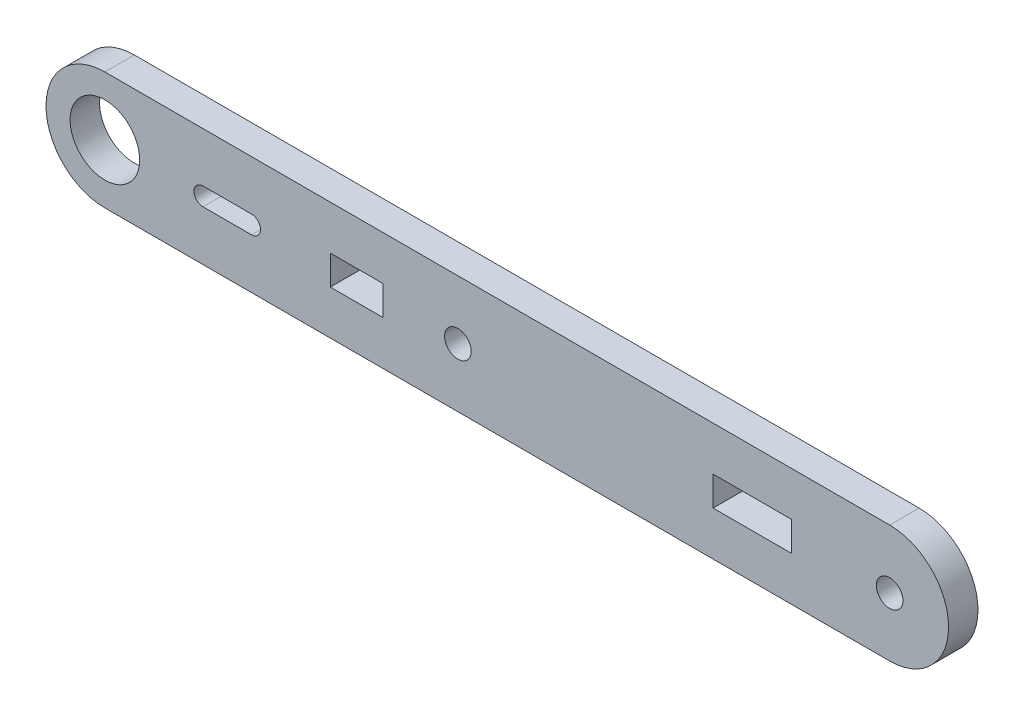
from build123d import *

# Parameters (mm, degrees)
SKETCH_1_R      = 3.543825796
SKETCH_1_R_2    = 1.357591064
SKETCH_1_W      = 5.3728
SKETCH_1_H      = 3.0001
SKETCH_1_W_2    = 7.9992
EXTRUDE_1_DEPTH = 3


with BuildPart() as part:
    # 草图1 → 凸台-拉伸1 (new body)
    with BuildSketch(Plane.XY.offset(3)):
        with BuildLine():
            Line((-49.343510787, 0), (30.618171933, 0))
            ThreePointArc((30.618171933, 0), (36.618171933, 6), (30.618171933, 12))
            Line((30.618171933, 12), (-49.343510787, 12))
            ThreePointArc((-49.343510787, 12), (-55.343510787, 6), (-49.343510787, 0))
        make_face()
        with Locations((-49.343510787, 6)):
            Circle(SKETCH_1_R, mode=Mode.SUBTRACT)
        with Locations((-13.375343302, 6.0002)):
            Circle(SKETCH_1_R_2, mode=Mode.SUBTRACT)
        with Locations((30.611606698, 6.0001)):
            Circle(SKETCH_1_R_2, mode=Mode.SUBTRACT)
        with Locations((-23.691393302, 5.99945)):
            Rectangle(SKETCH_1_W, SKETCH_1_H, mode=Mode.SUBTRACT)
        with BuildLine():
            Line((-39.352347519, 6.934252935), (-34.404739086, 6.934252935))
            ThreePointArc((-34.404739086, 6.934252935), (-33.487662618, 6.017176468), (-34.404739086, 5.1001))
            Line((-34.404739086, 5.1001), (-39.352347519, 5.1001))
            ThreePointArc((-39.352347519, 5.1001), (-40.269423986, 6.017176468), (-39.352347519, 6.934252935))
        make_face(mode=Mode.SUBTRACT)
        with Locations((16.621706698, 5.99945)):
            Rectangle(SKETCH_1_W_2, SKETCH_1_H, mode=Mode.SUBTRACT)
    extrude(amount=-EXTRUDE_1_DEPTH)


solid = part.part
